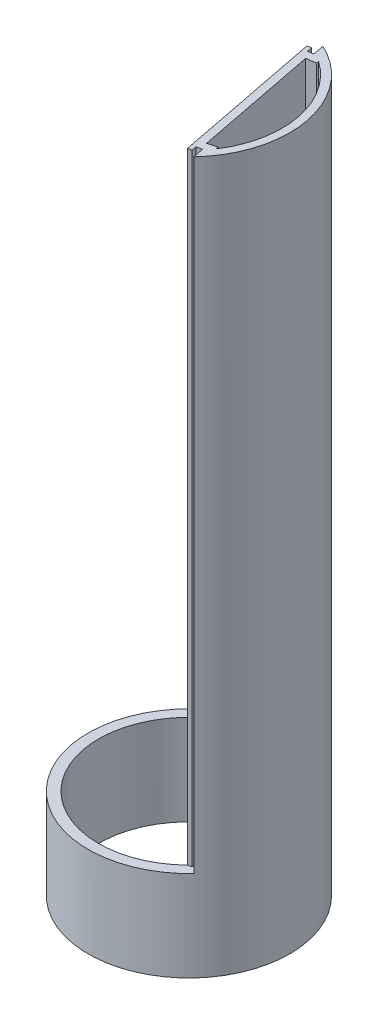
from build123d import *
from build123d.topology import SkipClean

# Parameters (mm, degrees)
BOSS_EXTRUDE1_DEPTH = 120
BOSS_EXTRUDE3_DEPTH = 7.5
BOSS_EXTRUDE2_START = 17.5
SKETCH26_R          = 19.5
SKETCH26_R_2        = 17.5
BOSS_EXTRUDE2_DEPTH = 17.5


with BuildPart() as part:
    # Sketch12 → Boss-Extrude1 (new body)
    with BuildSketch(Plane(origin=(0, 0, 0), x_dir=(1, 0, 0), z_dir=(0, 1, 0))):
        with BuildLine():
            Line((13.836638735, -11.183931196), (14.250877044, -13.310240549))
            ThreePointArc((14.250877044, -13.310240549), (19.139762737, 3.730882249), (8.20840412, 17.688191027))
            Line((8.20840412, 17.688191027), (8.634693417, 15.51841097))
            Line((8.634693417, 15.51841097), (7.567993782, 15.364331637))
            Line((7.567993782, 15.364331637), (7.375159644, 16.345842711))
            Line((7.375159644, 16.345842711), (6.621374847, 16.1773853))
            Line((6.621374847, 16.1773853), (12.217996211, -12.500838715))
            Line((12.217996211, -12.500838715), (12.971781009, -12.381940525))
            Line((12.971781009, -12.381940525), (12.790172439, -11.44177067))
            Line((12.790172439, -11.44177067), (13.836638735, -11.183931196))
        make_face()
        with BuildLine():
            ThreePointArc((15.095946542, -9.80369308), (17.668094122, 3.440704885), (10.313934488, 14.752042414))
            Line((10.313934488, 14.752042414), (10.410725736, 14.259382331))
            Line((10.410725736, 14.259382331), (8.575701021, 13.994322351))
            Line((8.575701021, 13.994322351), (13.217578727, -9.79160134))
            Line((13.217578727, -9.79160134), (15.007665389, -9.350540786))
            Line((15.007665389, -9.350540786), (15.095946542, -9.80369308))
        make_face(mode=Mode.SUBTRACT)
    extrude(amount=BOSS_EXTRUDE1_DEPTH)

    # Sketch28 → Boss-Extrude3 (add, symmetric)
    with BuildSketch(Plane.XZ):
        with BuildLine():
            Line((10.410725736, -14.259382331), (10.313927689, -14.752054328))
            ThreePointArc((10.313927689, -14.752054328), (17.668099364, -3.44070867), (15.095947667, 9.803702123))
            Line((15.095947667, 9.803702123), (15.007665389, 9.350540786))
            Line((15.007665389, 9.350540786), (13.217574825, 9.791607451))
            Line((13.217574825, 9.791607451), (8.575695107, -13.994326549))
            Line((8.575695107, -13.994326549), (10.410725736, -14.259382331))
        make_face()
    extrude(amount=BOSS_EXTRUDE3_DEPTH, both=True)

    # Sketch26 → Boss-Extrude2 (add)
    with SkipClean():  # the faces are left unmerged after this step: merging them gives an invalid solid
        with BuildSketch(Plane.XZ.offset(BOSS_EXTRUDE2_START)):
            with Locations(Location((0, 0, 0), (0, 0, 270))):
                Circle(SKETCH26_R)
            with Locations(Location((0, 0, 0), (0, 0, 45.563469932))):
                Circle(SKETCH26_R_2, mode=Mode.SUBTRACT)
        extrude(amount=-BOSS_EXTRUDE2_DEPTH)


solid = part.part
